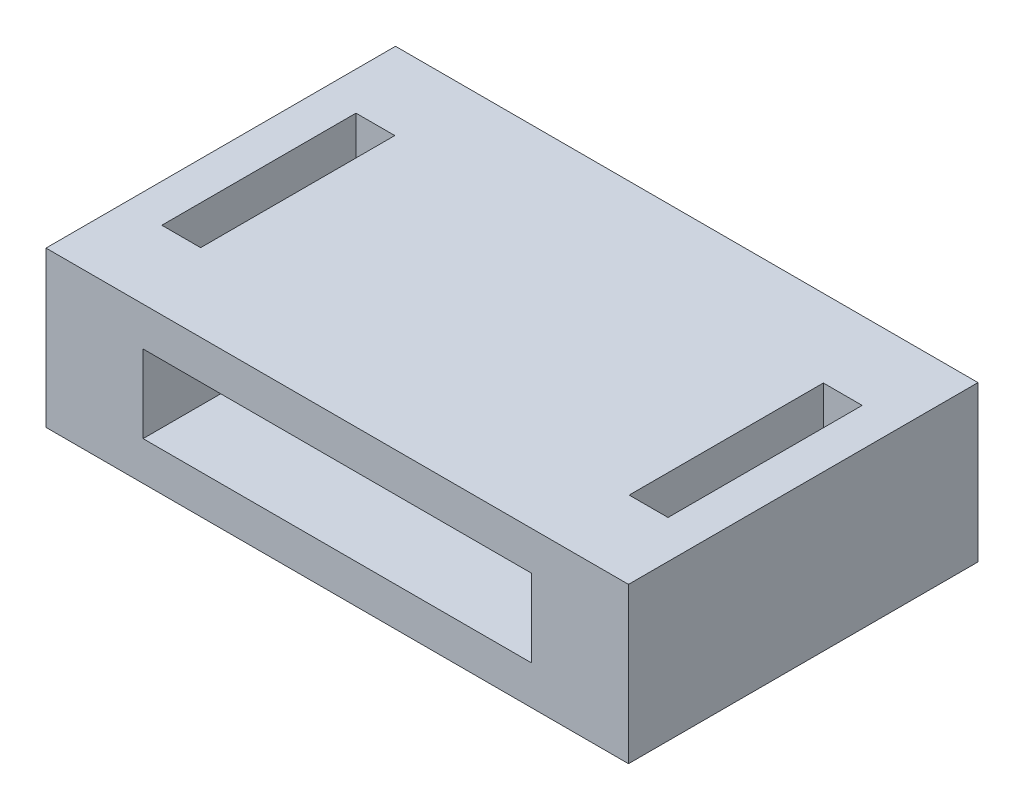
from build123d import *

# Parameters (mm, degrees)
SKETCH1_W           = 38.1
SKETCH1_H           = 22.86
SKETCH1_W_2         = 2.54
SKETCH1_H_2         = 12.7
BOSS_EXTRUDE2_DEPTH = 2.54
SKETCH3_R           = 1.016
BOSS_EXTRUDE3_DEPTH = 5.08
BOSS_EXTRUDE5_DEPTH = 5.08
SKETCH6_W           = 2.54
SKETCH6_H           = 12.7
CUT_EXTRUDE1_DEPTH  = 24.486417351
SKETCH4_W           = 38.1
SKETCH4_H           = 22.86
SKETCH4_W_2         = 2.54
SKETCH4_H_2         = 12.7
BOSS_EXTRUDE6_DEPTH = 2.54


with BuildPart() as part:
    # Sketch1 → Boss-Extrude2 (new body)
    with BuildSketch(Plane(origin=(0, 0, 0), x_dir=(1, 0, 0), z_dir=(0, 1, 0))):
        Rectangle(SKETCH1_W, SKETCH1_H)
        with Locations((-15.28489899, 0)):
            Rectangle(SKETCH1_W_2, SKETCH1_H_2, mode=Mode.SUBTRACT)
        with Locations((15.28489899, 0)):
            Rectangle(SKETCH1_W_2, SKETCH1_H_2, mode=Mode.SUBTRACT)
    extrude(amount=BOSS_EXTRUDE2_DEPTH)

    # Sketch3 → Boss-Extrude3 (add)
    with BuildSketch(Plane(origin=(0, 2.54, 0), x_dir=(1, 0, 0), z_dir=(0, 1, 0))):
        with Locations(Location((-5.318941048, 2.54, 0), (0, 0, 90))):
            Circle(SKETCH3_R)
        with Locations(Location((5.318941048, 2.54, 0), (0, 0, 90))):
            Circle(SKETCH3_R)
    extrude(amount=BOSS_EXTRUDE3_DEPTH)

    # Sketch5 → Boss-Extrude5 (add)
    with BuildSketch(Plane(origin=(0, 2.54, 0), x_dir=(1, 0, 0), z_dir=(0, 1, 0))):
        Polygon((-19.05, -11.43), (-19.05, 11.43), (19.05, 11.43), (19.05, -11.43), (12.7, -11.43), (12.7, 6.35), (-12.7, 6.35), (-12.7, -11.43), align=None)
    extrude(amount=BOSS_EXTRUDE5_DEPTH)

    # Sketch6 → Cut-Extrude1 (cut, through all)
    with BuildSketch(Plane(origin=(0, 7.62, 0), x_dir=(1, 0, 0), z_dir=(0, 1, 0))):
        with Locations((-15.28489899, 0)):
            Rectangle(SKETCH6_W, SKETCH6_H)
        with Locations((15.28489899, 0)):
            Rectangle(SKETCH6_W, SKETCH6_H)
    extrude(amount=-CUT_EXTRUDE1_DEPTH, mode=Mode.SUBTRACT)

    # Sketch4 → Boss-Extrude6 (add)
    with BuildSketch(Plane(origin=(0, 7.62, 0), x_dir=(1, 0, 0), z_dir=(0, 1, 0))):
        Rectangle(SKETCH4_W, SKETCH4_H)
        with Locations((-15.28489899, 0)):
            Rectangle(SKETCH4_W_2, SKETCH4_H_2, mode=Mode.SUBTRACT)
        with Locations((15.28489899, 0)):
            Rectangle(SKETCH4_W_2, SKETCH4_H_2, mode=Mode.SUBTRACT)
    extrude(amount=BOSS_EXTRUDE6_DEPTH)


solid = part.part
